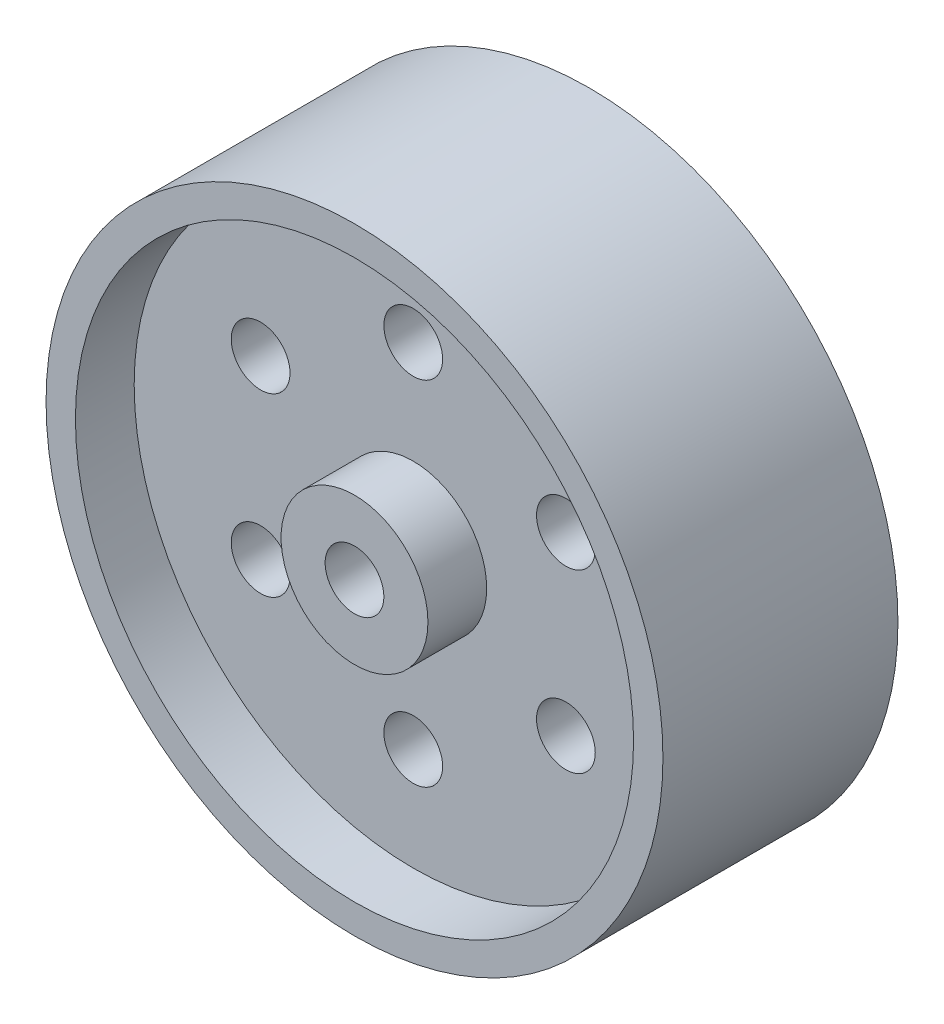
from build123d import *

# Parameters (mm, degrees)
SKETCH1_R           = 21
SKETCH1_R_2         = 5
SKETCH1_R_3         = 2
BOSS_EXTRUDE1_DEPTH = 8
BOSS_EXTRUDE2_START = 4
SKETCH1_3_R         = 21
SKETCH1_3_R_2       = 19
BOSS_EXTRUDE2_DEPTH = 4
SKETCH1_4_R         = 21
SKETCH1_4_R_2       = 19
SKETCH1_4_R_3       = 15
BOSS_EXTRUDE3_DEPTH = 12
SKETCH1_6_R         = 5
SKETCH1_6_R_2       = 2
BOSS_EXTRUDE4_DEPTH = 4
BOSS_EXTRUDE5_START = 4
SKETCH1_7_R         = 5
SKETCH1_7_R_2       = 2
BOSS_EXTRUDE5_DEPTH = 4
SKETCH1_8_R         = 5
SKETCH1_8_R_2       = 2
BOSS_EXTRUDE6_DEPTH = 8


with BuildPart() as part:
    # Sketch1 → Boss-Extrude1 (new body)
    with BuildSketch(Plane.XY):
        Circle(SKETCH1_R)
        Circle(SKETCH1_R_2, mode=Mode.SUBTRACT)
        with Locations((0, 12)):
            Circle(SKETCH1_R_3, mode=Mode.SUBTRACT)
        with Locations((10.392304845, 6)):
            Circle(SKETCH1_R_3, mode=Mode.SUBTRACT)
        with Locations((10.392304845, -6)):
            Circle(SKETCH1_R_3, mode=Mode.SUBTRACT)
        with Locations((0, -12)):
            Circle(SKETCH1_R_3, mode=Mode.SUBTRACT)
        with Locations((-10.392304845, -6)):
            Circle(SKETCH1_R_3, mode=Mode.SUBTRACT)
        with Locations((-10.392304845, 6)):
            Circle(SKETCH1_R_3, mode=Mode.SUBTRACT)
    extrude(amount=-BOSS_EXTRUDE1_DEPTH)

    # Sketch1<3> → Boss-Extrude2 (add)
    with BuildSketch(Plane.XY.offset(BOSS_EXTRUDE2_START)):
        Circle(SKETCH1_3_R)
        Circle(SKETCH1_3_R_2, mode=Mode.SUBTRACT)
    extrude(amount=-BOSS_EXTRUDE2_DEPTH)

    # Sketch1<4> → Boss-Extrude3 (add)
    # profile 1 of 2: a face of its own
    with BuildSketch(Plane.XY):
        Circle(SKETCH1_4_R)
        Circle(SKETCH1_4_R_2, mode=Mode.SUBTRACT)
    # profile 2 of 2: a face of its own
    with BuildSketch(Plane.XY):
        Circle(SKETCH1_4_R_2)
        Circle(SKETCH1_4_R_3, mode=Mode.SUBTRACT)
    extrude(amount=-BOSS_EXTRUDE3_DEPTH)



with BuildPart() as body_2:
    # Sketch1<6> → Boss-Extrude4 (new body)
    with BuildSketch(Plane.XY):
        Circle(SKETCH1_6_R)
        Circle(SKETCH1_6_R_2, mode=Mode.SUBTRACT)
    extrude(amount=BOSS_EXTRUDE4_DEPTH)

    # Sketch1<7> → Boss-Extrude5 (add)
    with BuildSketch(Plane.XY.offset(BOSS_EXTRUDE5_START)):
        Circle(SKETCH1_7_R)
        Circle(SKETCH1_7_R_2, mode=Mode.SUBTRACT)
    extrude(amount=-BOSS_EXTRUDE5_DEPTH)


with BuildPart() as part_1:
    add(part.part)

    add(body_2.part)  # Boss-Extrude6 merges body 2
    # Sketch1<8> → Boss-Extrude6 (add)
    with BuildSketch(Plane.XY):
        Circle(SKETCH1_8_R)
        Circle(SKETCH1_8_R_2, mode=Mode.SUBTRACT)
    extrude(amount=-BOSS_EXTRUDE6_DEPTH)


solid = part_1.part
